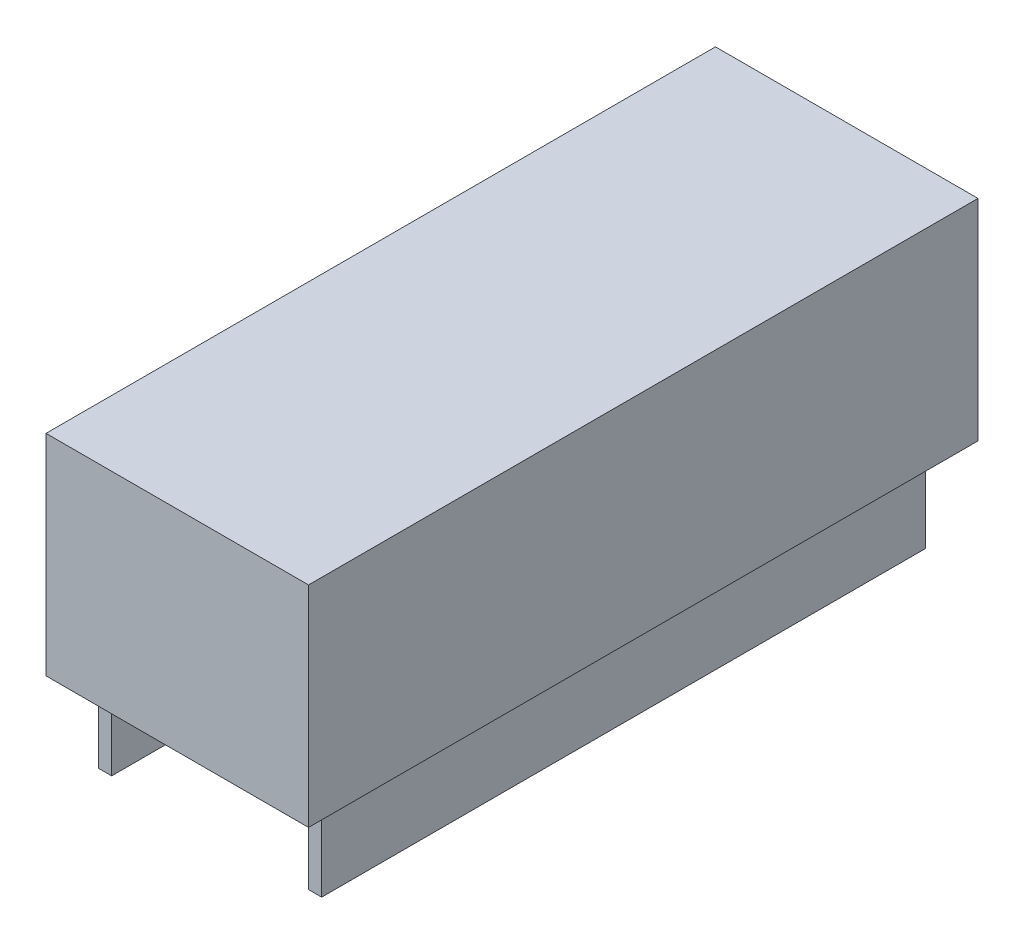
from build123d import *

# Parameters (mm, degrees)
SKETCH1_W           = 10
SKETCH1_H           = 25.5
BOSS_EXTRUDE1_DEPTH = 8
SKETCH2_W           = 0.5
SKETCH2_H           = 23
BOSS_EXTRUDE2_DEPTH = 3.3


with BuildPart() as part:
    # Sketch1 → Boss-Extrude1 (new body)
    with BuildSketch(Plane(origin=(0, 0, 0), x_dir=(1, 0, 0), z_dir=(0, 1, 0))):
        Rectangle(SKETCH1_W, SKETCH1_H)
    extrude(amount=-BOSS_EXTRUDE1_DEPTH)

    # Sketch2 → Boss-Extrude2 (add)
    with BuildSketch(Plane.XZ.offset(8)):
        with Locations((4, 0)):
            Rectangle(SKETCH2_W, SKETCH2_H)
        with Locations((-4, 0)):
            Rectangle(SKETCH2_W, SKETCH2_H)
    extrude(amount=BOSS_EXTRUDE2_DEPTH)


solid = part.part
